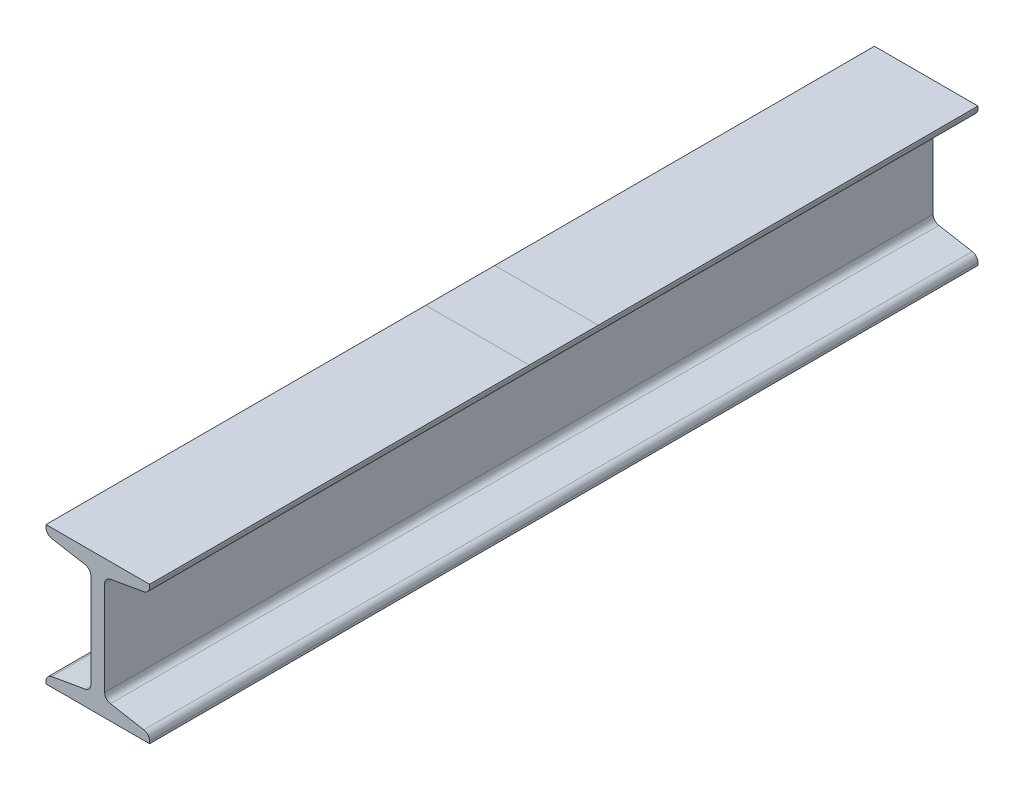
from build123d import *

# Parameters (mm, degrees)
BOSS_EXTRUDE1_DEPTH = 600
FILLET1_R           = 5


with BuildPart() as part:
    # Sketch2 → Boss-Extrude1 (new body)
    with BuildSketch(Plane.XY):
        Polygon((37.5, 50), (37.5, 44.0367195), (5, 38.306092627), (5, -38.306092627), (37.5, -44.0367195), (37.5, -50), (-37.5, -50), (-37.5, -44.0367195), (-5, -38.306092627), (-5, 38.306092627), (-37.5, 44.0367195), (-37.5, 50), align=None)
    extrude(amount=-BOSS_EXTRUDE1_DEPTH)

    # Fillet1
    fillet1_edges = [part.edges().sort_by_distance(p)[0] for p in [
        (37.5, 44.0367195, -300),
        (5, 38.306092627, -300),
        (5, -38.306092627, -300),
        (37.5, -44.0367195, -300),
        (-37.5, -44.0367195, -300),
        (-5, -38.306092627, -300),
        (-5, 38.306092627, -300),
        (-37.5, 44.0367195, -300),
    ]]
    fillet(fillet1_edges, radius=FILLET1_R)


solid = part.part
